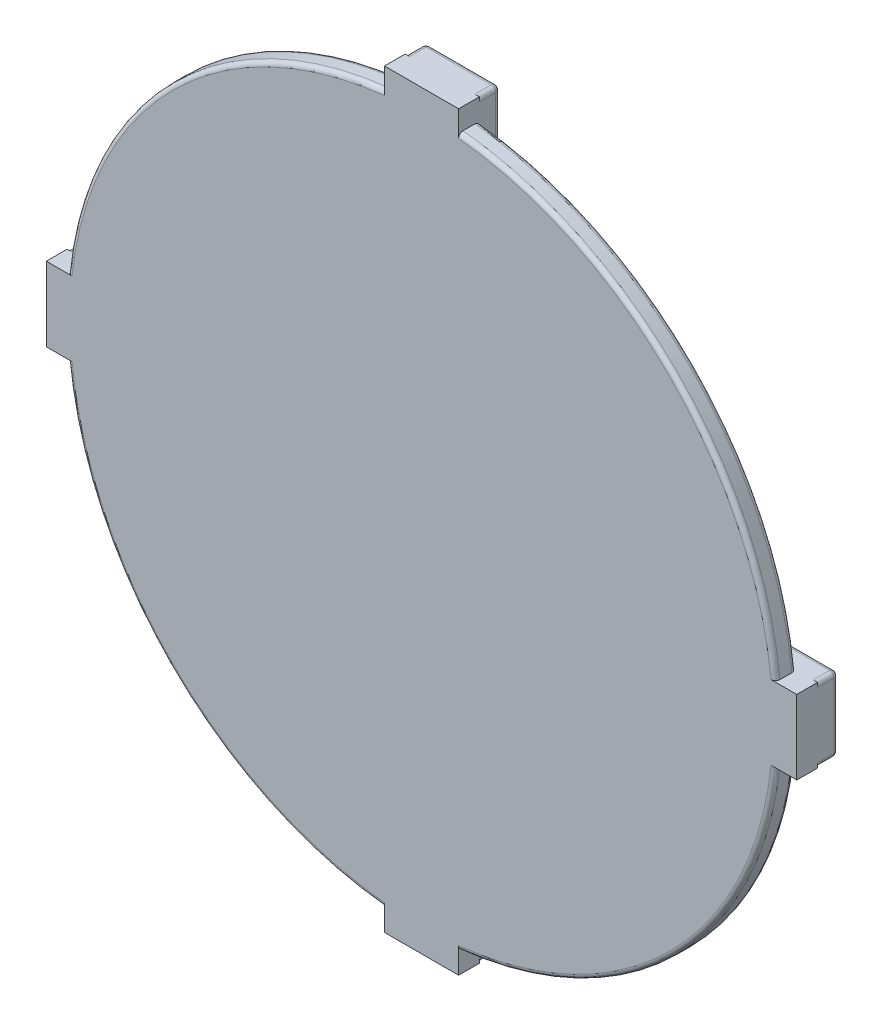
from build123d import *

# Parameters (mm, degrees)
SKETCH2_R           = 60.96
BOSS_EXTRUDE1_DEPTH = 3.556
FILLET1_R           = 0.762
SKETCH3_W           = 128.524
SKETCH3_H           = 12.7
BOSS_EXTRUDE2_DEPTH = 3.556
SKETCH4_W           = 12.7
SKETCH4_H           = 128.524
BOSS_EXTRUDE3_DEPTH = 3.556
FILLET2_R           = 0.762
SKETCH3_2_W         = 128.524
SKETCH3_2_H         = 12.7
BOSS_EXTRUDE4_DEPTH = 3.556
SKETCH4_2_W         = 12.7
SKETCH4_2_H         = 128.524
BOSS_EXTRUDE5_DEPTH = 3.556


with BuildPart() as part:
    # Sketch2 → Boss-Extrude1 (new body)
    with BuildSketch(Plane.XY):
        Circle(SKETCH2_R)
    extrude(amount=BOSS_EXTRUDE1_DEPTH)

    # Fillet1
    fillet1_edges = [part.edges().sort_by_distance(p)[0] for p in [
        (-60.96, 0, 0),
        (-60.96, 0, 3.556),
    ]]
    fillet(fillet1_edges, radius=FILLET1_R)

    # Sketch3 → Boss-Extrude2 (add)
    with BuildSketch(Plane.XY):
        Rectangle(SKETCH3_W, SKETCH3_H)
    extrude(amount=-BOSS_EXTRUDE2_DEPTH)

    # Sketch4 → Boss-Extrude3 (add)
    with BuildSketch(Plane.XY):
        Rectangle(SKETCH4_W, SKETCH4_H)
    extrude(amount=-BOSS_EXTRUDE3_DEPTH)

    # Fillet2
    fillet2_edges = [part.edges().sort_by_distance(p)[0] for p in [
        (35.306, 6.35, -3.556),
        (-64.262, 6.35, -1.778),
        (64.262, 0, -3.556),
        (64.262, 6.35, -1.778),
        (-35.306, -6.35, -3.556),
        (64.262, -6.35, -1.778),
        (-64.262, 0, -3.556),
        (-64.262, -6.35, -1.778),
        (-35.306, 6.35, -3.556),
        (35.306, -6.35, -3.556),
        (6.35, 35.306, -3.556),
        (6.35, 64.262, -1.778),
        (-6.35, 35.306, -3.556),
        (6.35, -35.306, -3.556),
        (0, -64.262, -3.556),
        (6.35, -64.262, -1.778),
        (-6.35, -35.306, -3.556),
        (-6.35, -64.262, -1.778),
        (0, 64.262, -3.556),
        (-6.35, 64.262, -1.778),
    ]]
    fillet(fillet2_edges, radius=FILLET2_R)

    # Sketch3<2> → Boss-Extrude4 (add)
    with BuildSketch(Plane.XY):
        Rectangle(SKETCH3_2_W, SKETCH3_2_H)
    extrude(amount=BOSS_EXTRUDE4_DEPTH)

    # Sketch4<2> → Boss-Extrude5 (add)
    with BuildSketch(Plane.XY):
        Rectangle(SKETCH4_2_W, SKETCH4_2_H)
    extrude(amount=BOSS_EXTRUDE5_DEPTH)


solid = part.part
